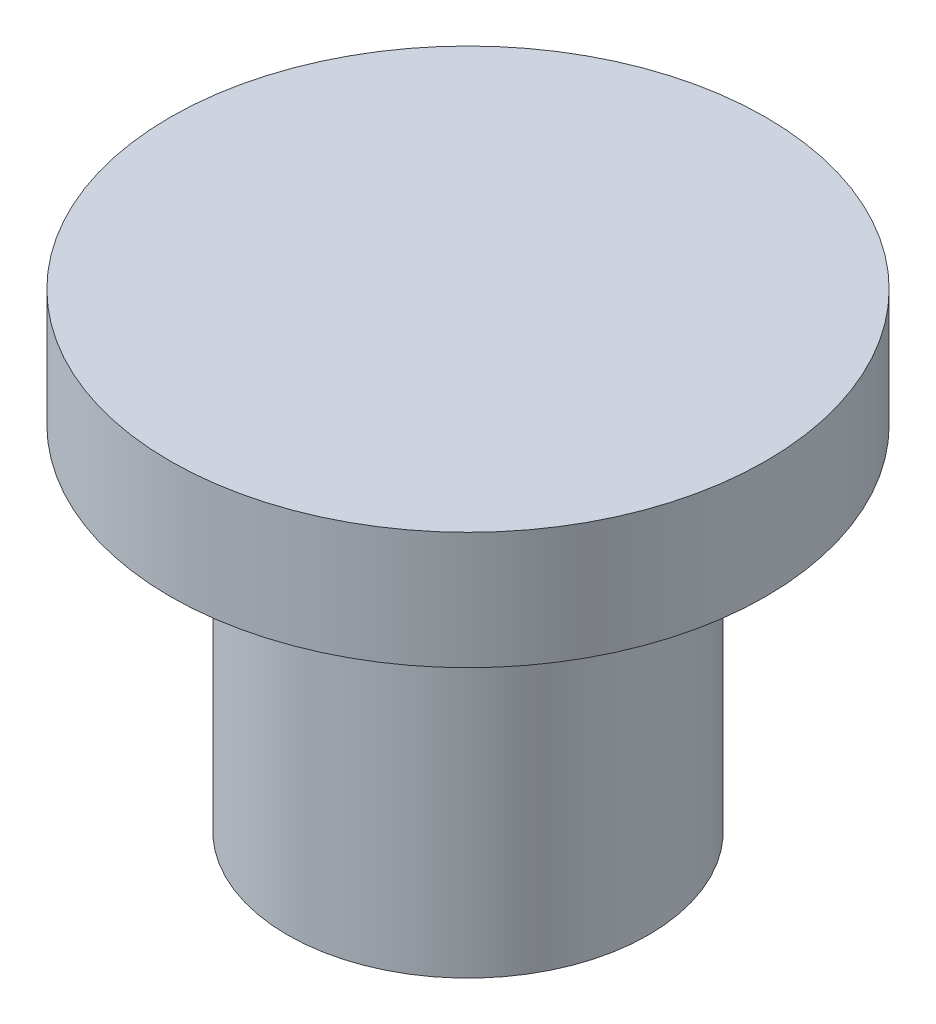
from build123d import *

# Parameters (mm, degrees)
ESBO_O2_W = 12.7
ESBO_O2_H = 20
ESBO_O3_W = 5
ESBO_O3_H = 15


with BuildPart() as part:
    # Esboço2 → Revolução2 (revolve)
    with BuildSketch(Plane.XY, mode=Mode.PRIVATE) as revolu_o2_sk:
        with Locations((6.35, 10)):
            Rectangle(ESBO_O2_W, ESBO_O2_H)
    revolve(revolu_o2_sk.sketch.rotate(Axis((0, 0, 0), (0, 1, 0)), 90), axis=Axis((0, 0, 0), (0, 1, 0)))

    # Esboço3 → Corte-Revolução1 (revolve, cut)
    with BuildSketch(Plane.XY, mode=Mode.PRIVATE) as corte_revolu_o1_sk:
        with Locations((10.2, 7.5)):
            Rectangle(ESBO_O3_W, ESBO_O3_H)
    revolve(corte_revolu_o1_sk.sketch.rotate(Axis((0, 0, 0), (0, 1, 0)), 90), axis=Axis((0, 0, 0), (0, 1, 0)), mode=Mode.SUBTRACT)


solid = part.part
